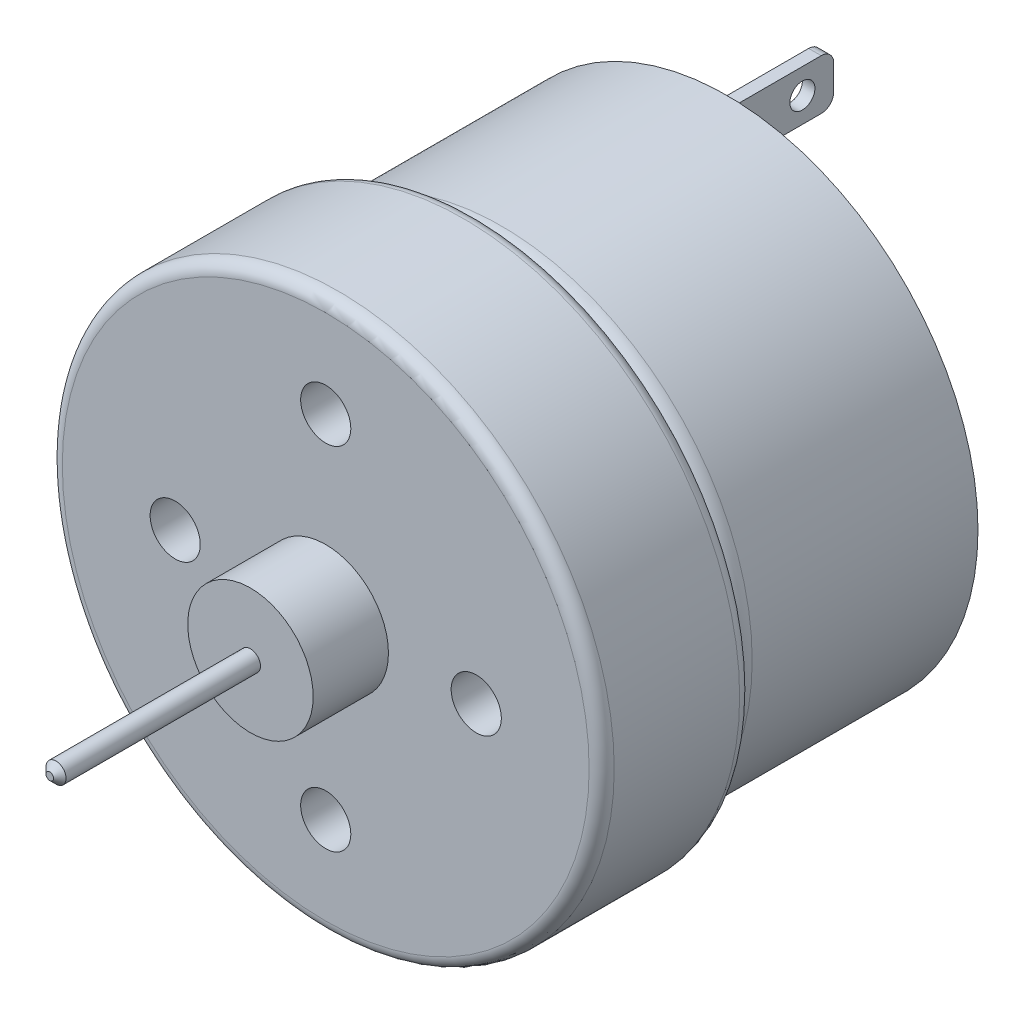
from build123d import *

# Parameters (mm, degrees)
SKETCH1_R            = 10
BOSS_EXTRUDE1_DEPTH  = 10
FILLET1_R            = 1
SKETCH2_R            = 3.25
BOSS_EXTRUDE2_DEPTH  = 2
SKETCH3_W            = 0.5
SKETCH3_H            = 2
BOSS_EXTRUDE4_DEPTH  = 4
SKETCH5_R            = 0.5
CUT_EXTRUDE2_DEPTH   = 4
FILLET3_R            = 0.5
FILLET3_OF_MIRROR2_R = 0.5
SKETCH6_R            = 11
BOSS_EXTRUDE5_DEPTH  = 6
FILLET4_R            = 0.5
SKETCH7_R            = 2.5
BOSS_EXTRUDE6_DEPTH  = 3
SKETCH8_R            = 0.4
BOSS_EXTRUDE7_DEPTH  = 8
CHAMFER1_SIZE        = 0.5
CHAMFER2_SIZE        = 0.25
SKETCH16_R           = 1
CUT_EXTRUDE3_DEPTH   = 8


with BuildPart() as part:
    # Sketch1 → Boss-Extrude1 (new body)
    with BuildSketch(Plane.XY):
        Circle(SKETCH1_R)
    extrude(amount=BOSS_EXTRUDE1_DEPTH)

    # Fillet1
    fillet1_edges = [part.edges().sort_by_distance(p)[0] for p in [
        (-10, 0, 10),
    ]]
    fillet(fillet1_edges, radius=FILLET1_R)

    # Sketch2 → Boss-Extrude2 (add)
    with BuildSketch(Plane(origin=(0, 0, 0), x_dir=(-1, 0, 0), z_dir=(0, 0, -1))):
        Circle(SKETCH2_R)
    extrude(amount=BOSS_EXTRUDE2_DEPTH)

    # Sketch3 → Boss-Extrude4 (add)
    with BuildSketch(Plane(origin=(0, 0, 0), x_dir=(-1, 0, 0), z_dir=(0, 0, -1))):
        with Locations((0, 8.75)):
            Rectangle(SKETCH3_W, SKETCH3_H)
    boss_extrude4 = extrude(amount=BOSS_EXTRUDE4_DEPTH)

    # Sketch5 → Cut-Extrude2 (cut)
    with BuildSketch(Plane.ZY.offset(0.25)):
        with Locations((-2.75, 8.75)):
            Circle(SKETCH5_R)
    cut_extrude2 = extrude(amount=-CUT_EXTRUDE2_DEPTH, mode=Mode.SUBTRACT)

    # Fillet3
    fillet3_edges = [part.edges().sort_by_distance(p)[0] for p in [
        (0, 7.75, -4),
        (0, 9.75, -4),
    ]]
    fillet(fillet3_edges, radius=FILLET3_R)

    # Mirror2: Boss-Extrude4, Cut-Extrude2 across plane
    add(boss_extrude4.mirror(Plane.ZX))
    add(cut_extrude2.mirror(Plane.ZX), mode=Mode.SUBTRACT)

    # Fillet3 of Mirror2
    fillet3_of_mirror2_edges = [part.edges().sort_by_distance(p)[0] for p in [
        (0, -7.75, -4),
        (0, -9.75, -4),
    ]]
    fillet(fillet3_of_mirror2_edges, radius=FILLET3_OF_MIRROR2_R)

    # Sketch6 → Boss-Extrude5 (add)
    with BuildSketch(Plane.XY.offset(10)):
        Circle(SKETCH6_R)
    extrude(amount=BOSS_EXTRUDE5_DEPTH)

    # Fillet4
    fillet4_edges = [part.edges().sort_by_distance(p)[0] for p in [
        (-11, 0, 16),
        (-11, 0, 10),
    ]]
    fillet(fillet4_edges, radius=FILLET4_R)

    # Sketch7 → Boss-Extrude6 (add)
    with BuildSketch(Plane.XY.offset(16)):
        Circle(SKETCH7_R)
    extrude(amount=BOSS_EXTRUDE6_DEPTH)

    # Sketch8 → Boss-Extrude7 (add)
    with BuildSketch(Plane.XY.offset(19)):
        Circle(SKETCH8_R)
    extrude(amount=BOSS_EXTRUDE7_DEPTH)

    # Chamfer1
    chamfer1_edges = [part.edges().sort_by_distance(p)[0] for p in [
        (3.25, 0, -2),
    ]]
    chamfer(chamfer1_edges, length=CHAMFER1_SIZE)

    # Chamfer2
    chamfer2_edges = [part.edges().sort_by_distance(p)[0] for p in [
        (-0.4, 0, 27),
    ]]
    chamfer(chamfer2_edges, length=CHAMFER2_SIZE)

    # Sketch16 → Cut-Extrude3 (cut)
    with BuildSketch(Plane.XY.offset(16)):
        with Locations((0, 7)):
            Circle(SKETCH16_R)
        with Locations((0, -7)):
            Circle(SKETCH16_R)
        with Locations((6, 0)):
            Circle(SKETCH16_R)
        with Locations((-6, 0)):
            Circle(SKETCH16_R)
    extrude(amount=-CUT_EXTRUDE3_DEPTH, mode=Mode.SUBTRACT)


solid = part.part
